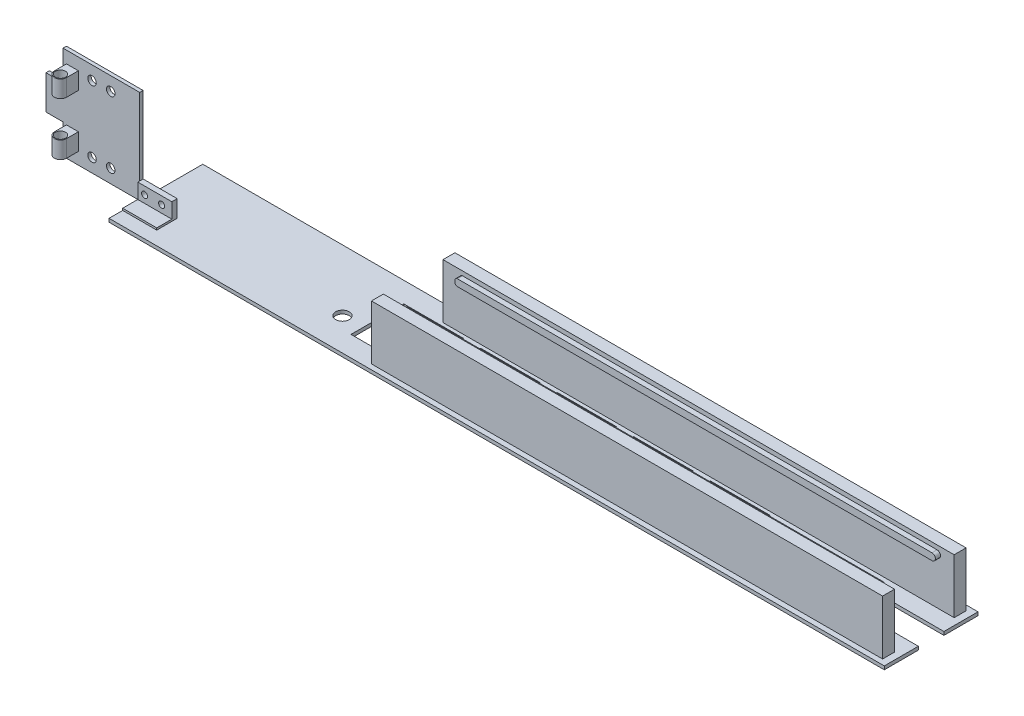
from build123d import *

# Parameters (mm, degrees)
CROQUIS1_W               = 45
CROQUIS1_H               = 55
CROQUIS1_R               = 2.5
SALIENTE_EXTRUIR1_DEPTH  = 2
CROQUIS2_W               = 10
CROQUIS2_H               = 20
SALIENTE_EXTRUIR2_DEPTH  = 2
CROQUIS4_R               = 3
SALIENTE_EXTRUIR4_DEPTH  = 10
CROQUIS6_W               = 2
CROQUIS6_H               = 10
SALIENTE_EXTRUIR6_DEPTH  = 20
CROQUIS7_W               = 455
CROQUIS7_H               = 55
SALIENTE_EXTRUIR7_DEPTH  = 2
CROQUIS8_W               = 60
CROQUIS8_H               = 15
CORTAR_EXTRUIR1_DEPTH    = 2
SALIENTE_EXTRUIR8_DEPTH  = 20
CROQUIS10_R              = 1.75
CORTAR_EXTRUIR2_DEPTH    = 480.688961724
CROQUIS11_W              = 300
CROQUIS11_H              = 7
SALIENTE_EXTRUIR9_DEPTH  = 32
SALIENTE_EXTRUIR10_DEPTH = 3
CROQUIS17_R              = 4
CORTAR_EXTRUIR4_DEPTH    = 10
CROQUIS18_W              = 35
CROQUIS18_H              = 31
CORTAR_EXTRUIR5_DEPTH    = 10
CROQUIS19_R              = 4
CORTAR_EXTRUIR6_DEPTH    = 10
CROQUIS22_R              = 6.5
CROQUIS22_R_2            = 4
SALIENTE_EXTRUIR11_DEPTH = 8.5


with BuildPart() as part:
    # Croquis1 → Saliente-Extruir1 (new body)
    with BuildSketch(Plane.XY):
        Rectangle(CROQUIS1_W, CROQUIS1_H)
        with Locations((5.5, 19.5)):
            Circle(CROQUIS1_R, mode=Mode.SUBTRACT)
        with Locations((-5.5, 19.5)):
            Circle(CROQUIS1_R, mode=Mode.SUBTRACT)
        with Locations((-5.5, -19.5)):
            Circle(CROQUIS1_R, mode=Mode.SUBTRACT)
        with Locations((5.5, -19.5)):
            Circle(CROQUIS1_R, mode=Mode.SUBTRACT)
    extrude(amount=SALIENTE_EXTRUIR1_DEPTH)

    # Croquis2 → Saliente-Extruir2 (add)
    with BuildSketch(Plane(origin=(0, 0, 0), x_dir=(-1, 0, 0), z_dir=(0, 0, -1))):
        with Locations((27.5, 0)):
            Rectangle(CROQUIS2_W, CROQUIS2_H)
    extrude(amount=-SALIENTE_EXTRUIR2_DEPTH)

    # Croquis4 → Saliente-Extruir4 (add)
    with BuildSketch(Plane(origin=(0, -20.5, 0), x_dir=(-1, 0, 0), z_dir=(0, -1, 0))):
        with BuildLine():
            Line((13.5, -2), (20.5, -2))
            Line((20.5, -2), (20.5, -9))
            ThreePointArc((20.5, -9), (17, -12.5), (13.5, -9))
            Line((13.5, -9), (13.5, -2))
        make_face()
        with Locations(Location((17, -9, 0), (0, 0, 90))):
            Circle(CROQUIS4_R, mode=Mode.SUBTRACT)
    saliente_extruir4 = extrude(amount=-SALIENTE_EXTRUIR4_DEPTH)

    # Simetría1: Saliente-Extruir4 across plane
    add(saliente_extruir4.mirror(Plane.ZX))

    # Croquis6 → Saliente-Extruir6 (add)
    with BuildSketch(Plane(origin=(22.5, 0, 0), x_dir=(0, 0, -1), z_dir=(1, 0, 0))):
        with Locations((-1, -22.5)):
            Rectangle(CROQUIS6_W, CROQUIS6_H)
    extrude(amount=SALIENTE_EXTRUIR6_DEPTH)

    # Croquis7 → Saliente-Extruir7 (add)
    with BuildSketch(Plane(origin=(0, -27.5, 0), x_dir=(1, 0, 0), z_dir=(0, 1, 0))):
        with Locations((250, 7.5)):
            Rectangle(CROQUIS7_W, CROQUIS7_H)
    extrude(amount=-SALIENTE_EXTRUIR7_DEPTH)

    # Croquis8 → Cortar-Extruir1 (cut)
    with BuildSketch(Plane(origin=(0, -29.5, 0), x_dir=(-1, 0, 0), z_dir=(0, -1, 0))):
        with Locations((-447.5, 7.5)):
            Rectangle(CROQUIS8_W, CROQUIS8_H)
    extrude(amount=-CORTAR_EXTRUIR1_DEPTH, mode=Mode.SUBTRACT)

    # Croquis9 → Saliente-Extruir8 (add)
    with BuildSketch(Plane(origin=(42.5, 0, 0), x_dir=(0, 0, -1), z_dir=(1, 0, 0))):
        Polygon((-2, -26.357753354), (-2, -17.5), (-3.142246646, -17.5), (-3.142246646, -26.357753354), (-12, -26.357753354), (-12, -27.5), (-2, -27.5), align=None)
    extrude(amount=-SALIENTE_EXTRUIR8_DEPTH)

    # Croquis10 → Cortar-Extruir2 (cut, through all)
    with BuildSketch(Plane(origin=(0, 0, 0), x_dir=(-1, 0, 0), z_dir=(0, 0, -1))):
        with Locations((-26.5, -22)):
            Circle(CROQUIS10_R)
        with Locations((-36.5, -22)):
            Circle(CROQUIS10_R)
    extrude(amount=-CORTAR_EXTRUIR2_DEPTH, mode=Mode.SUBTRACT)

    # Croquis11 → Saliente-Extruir9 (add)
    with BuildSketch(Plane(origin=(0, -27.5, 0), x_dir=(1, 0, 0), z_dir=(0, 1, 0))):
        with Locations((323.5, 28.5)):
            Rectangle(CROQUIS11_W, CROQUIS11_H)
        with Locations((323.5, -13.5)):
            Rectangle(CROQUIS11_W, CROQUIS11_H)
    extrude(amount=SALIENTE_EXTRUIR9_DEPTH)

    # Croquis13 → Saliente-Extruir10 (add)
    with BuildSketch(Plane(origin=(0, 0, 10), x_dir=(-1, 0, 0), z_dir=(0, 0, -1))):
        with BuildLine():
            Line((-463.5, 2), (-185, 2))
            ThreePointArc((-185, 2), (-183.939339828, 1.560660172), (-183.5, 0.5))
            Line((-183.5, 0.5), (-183.5, -0.5))
            ThreePointArc((-183.5, -0.5), (-183.939339828, -1.560660172), (-185, -2))
            Line((-185, -2), (-463.5, -2))
            ThreePointArc((-463.5, -2), (-465.5, 0), (-463.5, 2))
        make_face()
    saliente_extruir10 = extrude(amount=SALIENTE_EXTRUIR10_DEPTH)

    # Simetría2: Saliente-Extruir10 across plane
    add(saliente_extruir10.mirror(Plane(origin=(0, 0, -7.5), x_dir=(1, 0, 0), z_dir=(0, 0, -1))))

    # Croquis17 → Cortar-Extruir4 (cut)
    with BuildSketch(Plane(origin=(0, -27.5, 0), x_dir=(1, 0, 0), z_dir=(0, 1, 0))):
        with Locations(Location((140.5, -1, 0), (0, 0, 270))):
            Circle(CROQUIS17_R)
    extrude(amount=-CORTAR_EXTRUIR4_DEPTH, mode=Mode.SUBTRACT)

    # Croquis18 → Cortar-Extruir5 (cut)
    with BuildSketch(Plane(origin=(0, -27.5, 0), x_dir=(1, 0, 0), z_dir=(0, 1, 0))):
        with Locations((170, 7.5)):
            Rectangle(CROQUIS18_W, CROQUIS18_H)
        with Locations((215, 7.5)):
            Rectangle(CROQUIS18_W, CROQUIS18_H)
        with Locations((260, 7.5)):
            Rectangle(CROQUIS18_W, CROQUIS18_H)
        with Locations((305, 7.5)):
            Rectangle(CROQUIS18_W, CROQUIS18_H)
        with Locations((350, 7.5)):
            Rectangle(CROQUIS18_W, CROQUIS18_H)
    extrude(amount=-CORTAR_EXTRUIR5_DEPTH, mode=Mode.SUBTRACT)

    # Croquis19 → Cortar-Extruir6 (cut)
    with BuildSketch(Plane(origin=(0, -27.5, 0), x_dir=(1, 0, 0), z_dir=(0, 1, 0))):
        with Locations(Location((384.5, 0, 0), (0, 0, 270))):
            Circle(CROQUIS19_R)
    extrude(amount=-CORTAR_EXTRUIR6_DEPTH, mode=Mode.SUBTRACT)

    # Croquis22 → Saliente-Extruir11 (add)
    with BuildSketch(Plane.XZ.offset(29.5)):
        with Locations(Location((384.5, 0, 0), (0, 0, 90))):
            Circle(CROQUIS22_R)
        with Locations(Location((384.5, 0, 0), (0, 0, 90))):
            Circle(CROQUIS22_R_2, mode=Mode.SUBTRACT)
    extrude(amount=SALIENTE_EXTRUIR11_DEPTH)


solid = part.part
